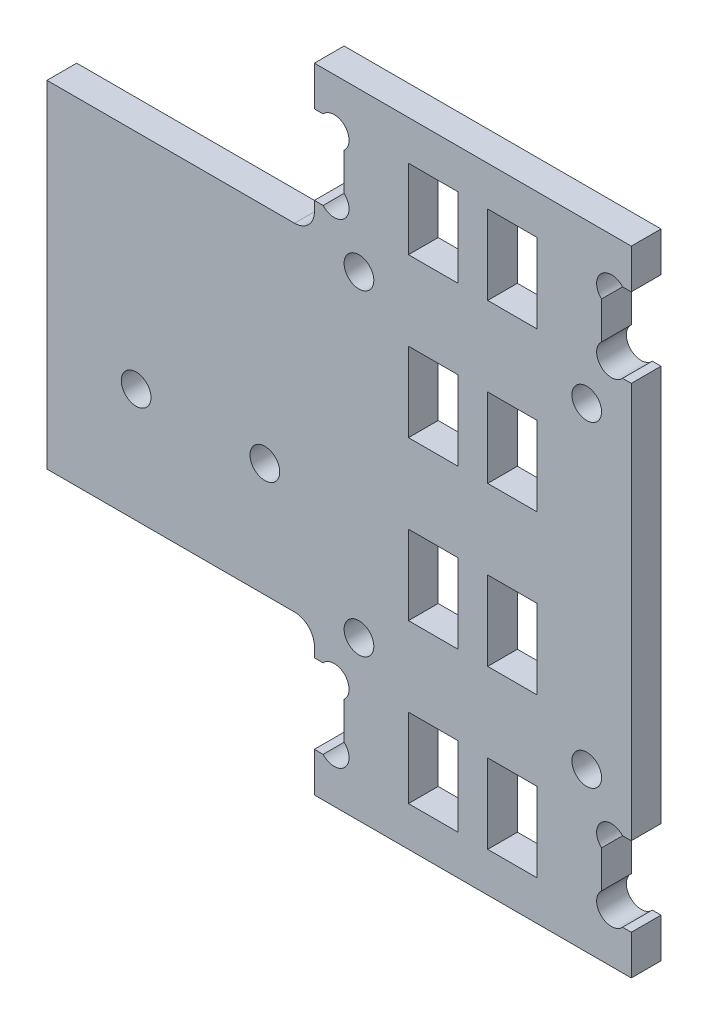
from build123d import *

# Parameters (mm, degrees)
SKETCH_1_W                = 32
SKETCH_1_H                = 64
EXTRUDE_1_DEPTH           = 3
SKETCH_2_W                = 2.5
SKETCH_2_H                = 4
CUT_EXTRUDE_1_DEPTH       = 36.902646142
MIRROR_2_COPY_1_SKETCH_W  = 2.5
MIRROR_2_COPY_1_SKETCH_H  = 4
MIRROR_2_COPY_1_DEPTH     = 36.902646142
SKETCH_4_W                = 3
SKETCH_4_H                = 8
CUT_EXTRUDE_3_DEPTH       = 36.902646142
MIRROR_6_COPY_1_SKETCH_W  = 3
MIRROR_6_COPY_1_SKETCH_H  = 8
MIRROR_6_COPY_1_DEPTH     = 36.902646142
SKETCH_6_W                = 3
SKETCH_6_H                = 8
CUT_EXTRUDE_4_DEPTH       = 36.902646142
MIRROR_8_COPY_1_SKETCH_W  = 3
MIRROR_8_COPY_1_SKETCH_H  = 8
MIRROR_8_COPY_1_DEPTH     = 36.902646142
SKETCH_7_R                = 1.5
CUT_EXTRUDE_5_DEPTH       = 36.902646142
MIRROR_10_COPY_1_SKETCH_R = 1.5
MIRROR_10_COPY_1_DEPTH    = 36.902646142
SKETCH_8_R                = 1.5
CUT_EXTRUDE_6_DEPTH       = 36.902646142
MIRROR_12_COPY_1_SKETCH_R = 1.5
MIRROR_12_COPY_1_DEPTH    = 36.902646142
SKETCH_11_R               = 1.5
CUT_EXTRUDE_9_DEPTH       = 36.902646142
MIRROR_16_COPY_1_SKETCH_R = 1.5
MIRROR_16_COPY_1_DEPTH    = 36.902646142
SKETCH_12_W               = 5
SKETCH_12_H               = 8
CUT_EXTRUDE_10_DEPTH      = 36.902646142
MIRROR_18_COPY_1_SKETCH_W = 5
MIRROR_18_COPY_1_SKETCH_H = 8
MIRROR_18_COPY_1_DEPTH    = 36.902646142
SKETCH_13_W               = 3.954651238
SKETCH_13_H               = 10.848263898
SKETCH_13_W_2             = 4.227382692
SKETCH_13_H_2             = 10.655405874
EXTRUDE_2_DEPTH           = 3
SKETCH_14_W               = 27
SKETCH_14_H               = 34
EXTRUDE_3_DEPTH           = 3
SKETCH_15_R               = 1.5
CUT_EXTRUDE_11_DEPTH      = 54.684262126
FILLET_1_R                = 2


with BuildPart() as part:
    # 草图1 → 凸台-拉伸1 (new body)
    with BuildSketch(Plane.XY):
        Rectangle(SKETCH_1_W, SKETCH_1_H)
    extrude(amount=EXTRUDE_1_DEPTH)

    # 草图2 → 切除-拉伸1 (cut, through all)
    with BuildSketch(Plane.XY.offset(3)):
        Polygon((4, 8), (4, 4), (6.5, 4), (6.5, 12), (1.5, 12), (1.5, 8), align=None)
        with Locations((2.75, 6)):
            Rectangle(SKETCH_2_W, SKETCH_2_H)
    cut_extrude_1 = extrude(amount=-CUT_EXTRUDE_1_DEPTH, mode=Mode.SUBTRACT)

    # 镜向1: 切除-拉伸1 across plane
    add(cut_extrude_1.mirror(Plane(origin=(0, 0, 0), x_dir=(0, 0, 1), z_dir=(1, 0, 0))), mode=Mode.SUBTRACT)

    # 镜向2: 切除-拉伸1 across plane
    add(cut_extrude_1.mirror(Plane.ZX), mode=Mode.SUBTRACT)

    # 镜向2 copy 1 sketch → 镜向2 copy 1 (cut, through all)
    with BuildSketch(Plane(origin=(0, 0, 3), x_dir=(-1, 0, 0), z_dir=(0, 0, 1))):
        Polygon((4, 8), (4, 4), (6.5, 4), (6.5, 12), (1.5, 12), (1.5, 8), align=None)
        with Locations((2.75, 6)):
            Rectangle(MIRROR_2_COPY_1_SKETCH_W, MIRROR_2_COPY_1_SKETCH_H)
    extrude(amount=-MIRROR_2_COPY_1_DEPTH, mode=Mode.SUBTRACT)

    # 草图4 → 切除-拉伸3 (cut, through all)
    with BuildSketch(Plane.XY.offset(3)):
        with Locations((14.5, 8)):
            Rectangle(SKETCH_4_W, SKETCH_4_H)
    cut_extrude_3 = extrude(amount=-CUT_EXTRUDE_3_DEPTH, mode=Mode.SUBTRACT)

    # 镜向5: 切除-拉伸3 across plane
    add(cut_extrude_3.mirror(Plane(origin=(0, 0, 0), x_dir=(0, 0, 1), z_dir=(1, 0, 0))), mode=Mode.SUBTRACT)

    # 镜向6: 切除-拉伸3 across plane
    add(cut_extrude_3.mirror(Plane.ZX), mode=Mode.SUBTRACT)

    # 镜向6 copy 1 sketch → 镜向6 copy 1 (cut, through all)
    with BuildSketch(Plane(origin=(0, 0, 3), x_dir=(-1, 0, 0), z_dir=(0, 0, 1))):
        with Locations((14.5, 8)):
            Rectangle(MIRROR_6_COPY_1_SKETCH_W, MIRROR_6_COPY_1_SKETCH_H)
    extrude(amount=-MIRROR_6_COPY_1_DEPTH, mode=Mode.SUBTRACT)

    # 草图6 → 切除-拉伸4 (cut, through all)
    with BuildSketch(Plane.XY.offset(3)):
        with Locations((14.5, 24)):
            Rectangle(SKETCH_6_W, SKETCH_6_H)
    cut_extrude_4 = extrude(amount=-CUT_EXTRUDE_4_DEPTH, mode=Mode.SUBTRACT)

    # 镜向7: 切除-拉伸4 across plane
    add(cut_extrude_4.mirror(Plane(origin=(0, 0, 0), x_dir=(0, 0, 1), z_dir=(1, 0, 0))), mode=Mode.SUBTRACT)

    # 镜向8: 切除-拉伸4 across plane
    add(cut_extrude_4.mirror(Plane.ZX), mode=Mode.SUBTRACT)

    # 镜向8 copy 1 sketch → 镜向8 copy 1 (cut, through all)
    with BuildSketch(Plane(origin=(0, 0, 3), x_dir=(-1, 0, 0), z_dir=(0, 0, 1))):
        with Locations((14.5, 24)):
            Rectangle(MIRROR_8_COPY_1_SKETCH_W, MIRROR_8_COPY_1_SKETCH_H)
    extrude(amount=-MIRROR_8_COPY_1_DEPTH, mode=Mode.SUBTRACT)

    # 草图7 → 切除-拉伸5 (cut, through all)
    with BuildSketch(Plane.XY.offset(3)):
        with Locations((-14, 27)):
            Circle(SKETCH_7_R)
        with Locations((-14, 21)):
            Circle(SKETCH_7_R)
    cut_extrude_5 = extrude(amount=-CUT_EXTRUDE_5_DEPTH, mode=Mode.SUBTRACT)

    # 镜向9: 切除-拉伸5 across plane
    add(cut_extrude_5.mirror(Plane(origin=(0, 0, 0), x_dir=(0, 0, 1), z_dir=(1, 0, 0))), mode=Mode.SUBTRACT)

    # 镜向10: 切除-拉伸5 across plane
    add(cut_extrude_5.mirror(Plane.ZX), mode=Mode.SUBTRACT)

    # 镜向10 copy 1 sketch → 镜向10 copy 1 (cut, through all)
    with BuildSketch(Plane(origin=(0, 0, 3), x_dir=(-1, 0, 0), z_dir=(0, 0, 1))):
        with Locations((-14, 27)):
            Circle(MIRROR_10_COPY_1_SKETCH_R)
        with Locations((-14, 21)):
            Circle(MIRROR_10_COPY_1_SKETCH_R)
    extrude(amount=-MIRROR_10_COPY_1_DEPTH, mode=Mode.SUBTRACT)

    # 草图8 → 切除-拉伸6 (cut, through all)
    with BuildSketch(Plane.XY.offset(3)):
        with Locations((-14, 11)):
            Circle(SKETCH_8_R)
        with Locations((-14, 5)):
            Circle(SKETCH_8_R)
    cut_extrude_6 = extrude(amount=-CUT_EXTRUDE_6_DEPTH, mode=Mode.SUBTRACT)

    # 镜向11: 切除-拉伸6 across plane
    add(cut_extrude_6.mirror(Plane(origin=(0, 0, 0), x_dir=(0, 0, 1), z_dir=(1, 0, 0))), mode=Mode.SUBTRACT)

    # 镜向12: 切除-拉伸6 across plane
    add(cut_extrude_6.mirror(Plane.ZX), mode=Mode.SUBTRACT)

    # 镜向12 copy 1 sketch → 镜向12 copy 1 (cut, through all)
    with BuildSketch(Plane(origin=(0, 0, 3), x_dir=(-1, 0, 0), z_dir=(0, 0, 1))):
        with Locations((-14, 11)):
            Circle(MIRROR_12_COPY_1_SKETCH_R)
        with Locations((-14, 5)):
            Circle(MIRROR_12_COPY_1_SKETCH_R)
    extrude(amount=-MIRROR_12_COPY_1_DEPTH, mode=Mode.SUBTRACT)

    # 草图11 → 切除-拉伸9 (cut, through all)
    with BuildSketch(Plane.XY.offset(3)):
        with Locations((11.5, 16)):
            Circle(SKETCH_11_R)
    cut_extrude_9 = extrude(amount=-CUT_EXTRUDE_9_DEPTH, mode=Mode.SUBTRACT)

    # 镜向15: 切除-拉伸9 across plane
    add(cut_extrude_9.mirror(Plane(origin=(0, 0, 0), x_dir=(0, 0, 1), z_dir=(1, 0, 0))), mode=Mode.SUBTRACT)

    # 镜向16: 切除-拉伸9 across plane
    add(cut_extrude_9.mirror(Plane.ZX), mode=Mode.SUBTRACT)

    # 镜向16 copy 1 sketch → 镜向16 copy 1 (cut, through all)
    with BuildSketch(Plane(origin=(0, 0, 3), x_dir=(-1, 0, 0), z_dir=(0, 0, 1))):
        with Locations((11.5, 16)):
            Circle(MIRROR_16_COPY_1_SKETCH_R)
    extrude(amount=-MIRROR_16_COPY_1_DEPTH, mode=Mode.SUBTRACT)

    # 草图12 → 切除-拉伸10 (cut, through all)
    with BuildSketch(Plane.XY.offset(3)):
        with Locations((4, 24)):
            Rectangle(SKETCH_12_W, SKETCH_12_H)
    cut_extrude_10 = extrude(amount=-CUT_EXTRUDE_10_DEPTH, mode=Mode.SUBTRACT)

    # 镜向17: 切除-拉伸10 across plane
    add(cut_extrude_10.mirror(Plane(origin=(0, 0, 0), x_dir=(0, 0, 1), z_dir=(1, 0, 0))), mode=Mode.SUBTRACT)

    # 镜向18: 切除-拉伸10 across plane
    add(cut_extrude_10.mirror(Plane.ZX), mode=Mode.SUBTRACT)

    # 镜向18 copy 1 sketch → 镜向18 copy 1 (cut, through all)
    with BuildSketch(Plane(origin=(0, 0, 3), x_dir=(-1, 0, 0), z_dir=(0, 0, 1))):
        with Locations((4, 24)):
            Rectangle(MIRROR_18_COPY_1_SKETCH_W, MIRROR_18_COPY_1_SKETCH_H)
    extrude(amount=-MIRROR_18_COPY_1_DEPTH, mode=Mode.SUBTRACT)

    # 草图13 → 凸台-拉伸2 (add)
    with BuildSketch(Plane.XY.offset(3)):
        with Locations((-14.022674381, 8.035470268)):
            Rectangle(SKETCH_13_W, SKETCH_13_H)
        with Locations((13.886308654, 8.035470268)):
            Rectangle(SKETCH_13_W_2, SKETCH_13_H)
        with Locations((13.886308654, -7.875316782)):
            Rectangle(SKETCH_13_W_2, SKETCH_13_H_2)
        with Locations((-14.022674381, -7.875316782)):
            Rectangle(SKETCH_13_W, SKETCH_13_H_2)
    extrude(amount=-EXTRUDE_2_DEPTH)

    # 草图14 → 凸台-拉伸3 (add)
    with BuildSketch(Plane(origin=(0, 0, 0), x_dir=(-1, 0, 0), z_dir=(0, 0, -1))):
        with Locations((29.5, 0)):
            Rectangle(SKETCH_14_W, SKETCH_14_H)
    extrude(amount=-EXTRUDE_3_DEPTH)

    # 草图15 → 切除-拉伸11 (cut, through all)
    with BuildSketch(Plane(origin=(0, 0, 0), x_dir=(-1, 0, 0), z_dir=(0, 0, -1))):
        with Locations((34, -5.5)):
            Circle(SKETCH_15_R)
        with Locations((21, -5.5)):
            Circle(SKETCH_15_R)
    extrude(amount=-CUT_EXTRUDE_11_DEPTH, mode=Mode.SUBTRACT)

    # 圆角1
    fillet_1_edges = [part.edges().sort_by_distance(p)[0] for p in [
        (-16, -17, 1.5),
        (-16, 17, 1.5),
    ]]
    fillet(fillet_1_edges, radius=FILLET_1_R)


solid = part.part
